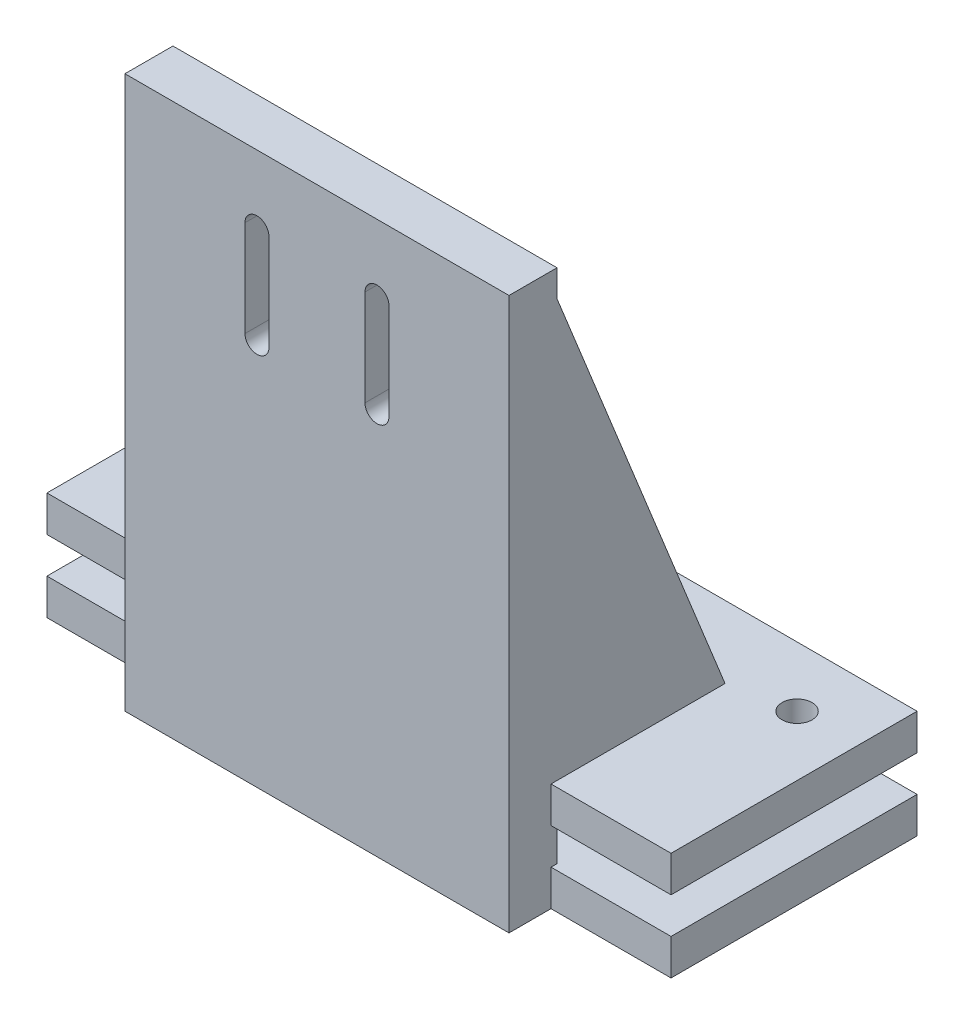
from build123d import *

# Parameters (mm, degrees)
SKETCH_1_W             = 64
SKETCH_1_H             = 92
EXTRUDE_348_DEPTH      = 8
EXTRUDE_START          = -40
SKETCH_2_W             = 104
SKETCH_2_H             = 6
EXTRUDE_C_6_DEPTH      = 41
SKETCH_3_W             = 104
SKETCH_3_H             = 6
EXTRUDE_C_6_2_DEPTH    = 41
EXTRUDE_START_2        = -32
EXTRUDE_798_DEPTH      = 6
EXTRUDE_START_3        = 26
EXTRUDE_5_DEPTH        = 6
CUT_EXTRUDE_8_DEPTH    = 8
CUT_EXTRUDE_START      = -11.5
SKETCH_7_R             = 2.5
CUT_EXTRUDE_1237_DEPTH = 18


with BuildPart() as part:
    # 草图1 → Extrude 348 (new body)
    with BuildSketch(Plane.XY):
        with Locations((0, 34.5)):
            Rectangle(SKETCH_1_W, SKETCH_1_H)
    extrude(amount=EXTRUDE_348_DEPTH)

    # 草图2 → Extrude C_6 (add)
    with BuildSketch(Plane.XY.offset(EXTRUDE_START)):
        with Locations((0, -8.5)):
            Rectangle(SKETCH_2_W, SKETCH_2_H)
    extrude(amount=EXTRUDE_C_6_DEPTH)

    # 草图3 → Extrude C_6 2 (add)
    with BuildSketch(Plane.XY.offset(EXTRUDE_START)):
        with Locations((0, 3.5)):
            Rectangle(SKETCH_3_W, SKETCH_3_H)
    extrude(amount=EXTRUDE_C_6_2_DEPTH)

    # 草图4 → Extrude 798 (add)
    with BuildSketch(Plane(origin=(0, 0, 0), x_dir=(0, 0, -1), z_dir=(1, 0, 0)).offset(EXTRUDE_START_2)):
        Polygon((28, 6.5), (-1, 6.5), (-1, 78.5), align=None)
    extrude(amount=EXTRUDE_798_DEPTH)

    # 草图5 → 凸台-拉伸5 (add)
    with BuildSketch(Plane(origin=(0, 0, 0), x_dir=(0, 0, -1), z_dir=(1, 0, 0)).offset(EXTRUDE_START_3)):
        Polygon((28, 6.5), (-1, 6.5), (-1, 78.5), align=None)
    extrude(amount=EXTRUDE_5_DEPTH)

    # 草图6 → 上下可调槽_中心行程正负8 (cut)
    with BuildSketch(Plane.XY):
        with BuildLine():
            Line((-8, 53), (-8, 69))
            ThreePointArc((-8, 69), (-10, 71), (-12, 69))
            Line((-12, 69), (-12, 53))
            ThreePointArc((-12, 53), (-10, 51), (-8, 53))
        make_face()
        with BuildLine():
            Line((12, 53), (12, 69))
            ThreePointArc((12, 69), (10, 71), (8, 69))
            Line((8, 69), (8, 53))
            ThreePointArc((8, 53), (10, 51), (12, 53))
        make_face()
    extrude(amount=CUT_EXTRUDE_8_DEPTH, mode=Mode.SUBTRACT)

    # 草图7 → Cut-Extrude 1237 (cut)
    with BuildSketch(Plane(origin=(0, 0, 0), x_dir=(1, 0, 0), z_dir=(0, 1, 0)).offset(CUT_EXTRUDE_START)):
        with Locations(Location((-42, 30, 0), (0, 0, 270))):
            Circle(SKETCH_7_R)
        with Locations(Location((42, 30, 0), (0, 0, 270))):
            Circle(SKETCH_7_R)
    extrude(amount=CUT_EXTRUDE_1237_DEPTH, mode=Mode.SUBTRACT)


solid = part.part
